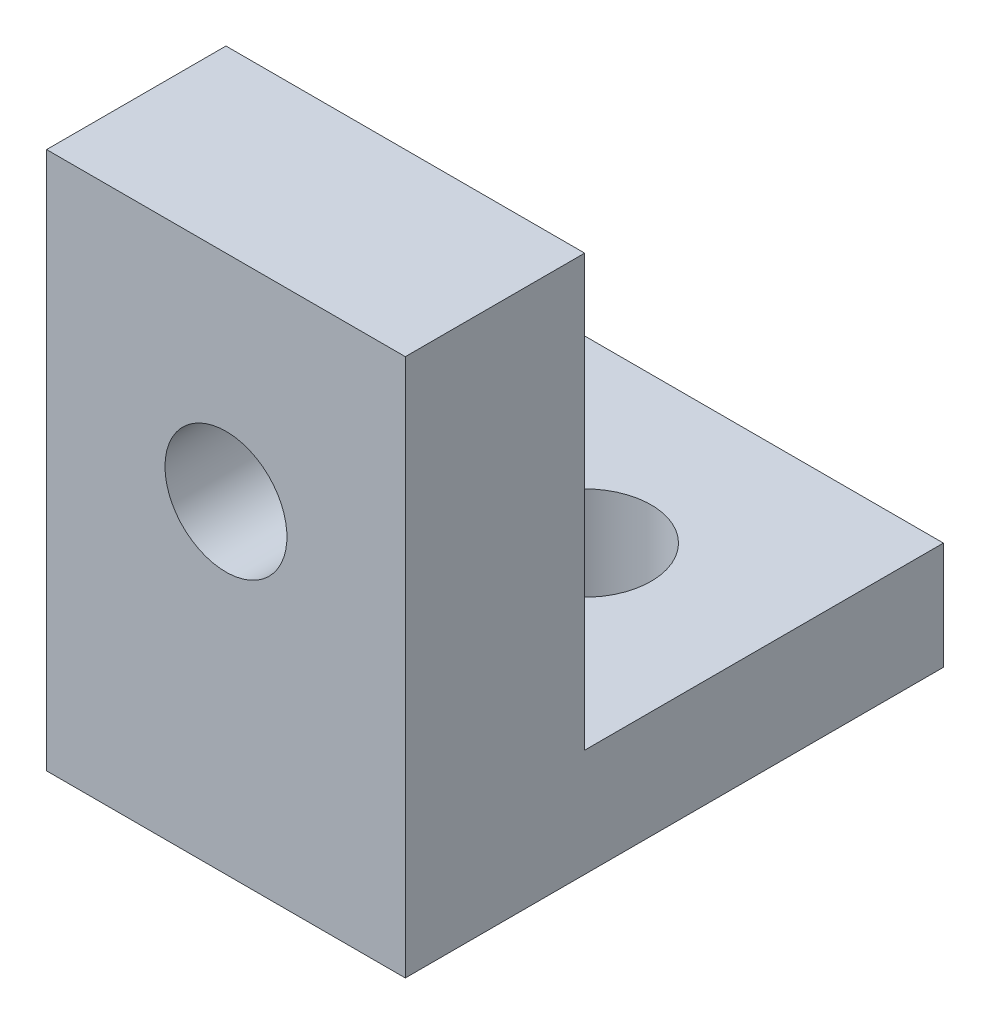
from build123d import *

# Parameters (mm, degrees)
BOSS_EXTRUDE1_DEPTH = 10
SKETCH2_R           = 1.85
CUT_EXTRUDE1_DEPTH  = 19.547236991
SKETCH4_R           = 1.7
CUT_EXTRUDE2_DEPTH  = 19.547236991
CUT_EXTRUDE3_DEPTH  = 2.5


with BuildPart() as part:
    # Sketch1 → Boss-Extrude1 (new body)
    with BuildSketch(Plane(origin=(0, 0, 0), x_dir=(0, 0, -1), z_dir=(1, 0, 0))):
        Polygon((-5, 12), (0, 12), (0, 0), (10, 0), (10, -3), (-5, -3), align=None)
    extrude(amount=BOSS_EXTRUDE1_DEPTH)

    # Sketch2 → Cut-Extrude1 (cut, through all)
    with BuildSketch(Plane(origin=(0, 0, 0), x_dir=(1, 0, 0), z_dir=(0, 1, 0))):
        with Locations(Location((5, 5, 0), (0, 0, 270))):
            Circle(SKETCH2_R)
    extrude(amount=-CUT_EXTRUDE1_DEPTH, mode=Mode.SUBTRACT)

    # Sketch4 → Cut-Extrude2 (cut, through all)
    with BuildSketch(Plane(origin=(0, 0, 0), x_dir=(-1, 0, 0), z_dir=(0, 0, -1))):
        with Locations((-5, 6)):
            Circle(SKETCH4_R)
    extrude(amount=-CUT_EXTRUDE2_DEPTH, mode=Mode.SUBTRACT)

    # Sketch5 → Cut-Extrude3 (cut)
    with BuildSketch(Plane(origin=(0, 0, 0), x_dir=(-1, 0, 0), z_dir=(0, 0, -1))):
        Polygon((-3.325684219, 3.1), (-1.651368439, 6), (-3.325684219, 8.9), (-6.674315781, 8.9), (-8.348631561, 6), (-6.674315781, 3.1), align=None)
    extrude(amount=-CUT_EXTRUDE3_DEPTH, mode=Mode.SUBTRACT)


solid = part.part
